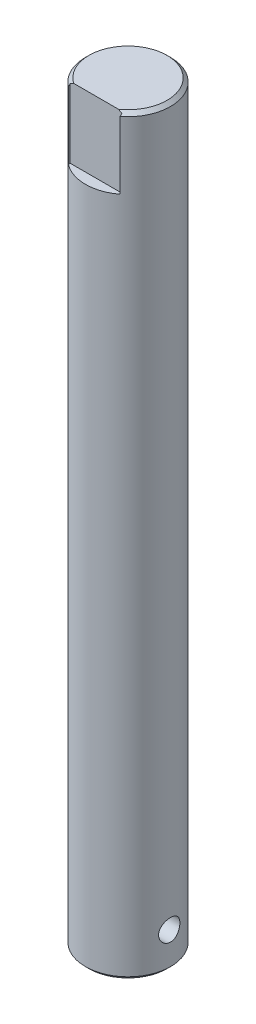
from build123d import *

# Parameters (mm, degrees)
SKETCH1_R               = 6
BOSS_EXTRUDE1_DEPTH     = 106
CHAMFER1_SIZE           = 0.5
CUT_EXTRUDE1_DEPTH      = 107.339080304
CUT_EXTRUDE1_DEPTH_BACK = 107.339080304
SKETCH2_R               = 1.5
SKETCH4_W               = 7.302801642
SKETCH4_H               = 16.597276459
CUT_EXTRUDE2_DEPTH      = 107.687628166


with BuildPart() as part:
    # Sketch1 → Boss-Extrude1 (new body)
    with BuildSketch(Plane(origin=(0, 0, 0), x_dir=(1, 0, 0), z_dir=(0, 1, 0))):
        with Locations(Location((0, 0, 0), (0, 0, 270))):
            Circle(SKETCH1_R)
    extrude(amount=BOSS_EXTRUDE1_DEPTH)

    # Chamfer1
    chamfer1_edges = [part.edges().sort_by_distance(p)[0] for p in [
        (0, 0, -6),
        (0, 106, -6),
    ]]
    chamfer(chamfer1_edges, length=CHAMFER1_SIZE)

    # Sketch2 → Cut-Extrude1 (cut, two sides: drawn at the far end of the back side and taken through both)
    with BuildSketch(Plane(origin=(0, 0, 0), x_dir=(0, 0, -1), z_dir=(1, 0, 0)).offset(-CUT_EXTRUDE1_DEPTH_BACK)):
        with Locations((0, 5)):
            Circle(SKETCH2_R)
    extrude(amount=CUT_EXTRUDE1_DEPTH + CUT_EXTRUDE1_DEPTH_BACK, mode=Mode.SUBTRACT)

    # Sketch4 → Cut-Extrude2 (cut, through all)
    with BuildSketch(Plane.XY.offset(4.5)):
        with Locations((0, 104.298638229)):
            Rectangle(SKETCH4_W, SKETCH4_H)
    extrude(amount=CUT_EXTRUDE2_DEPTH, mode=Mode.SUBTRACT)


solid = part.part
